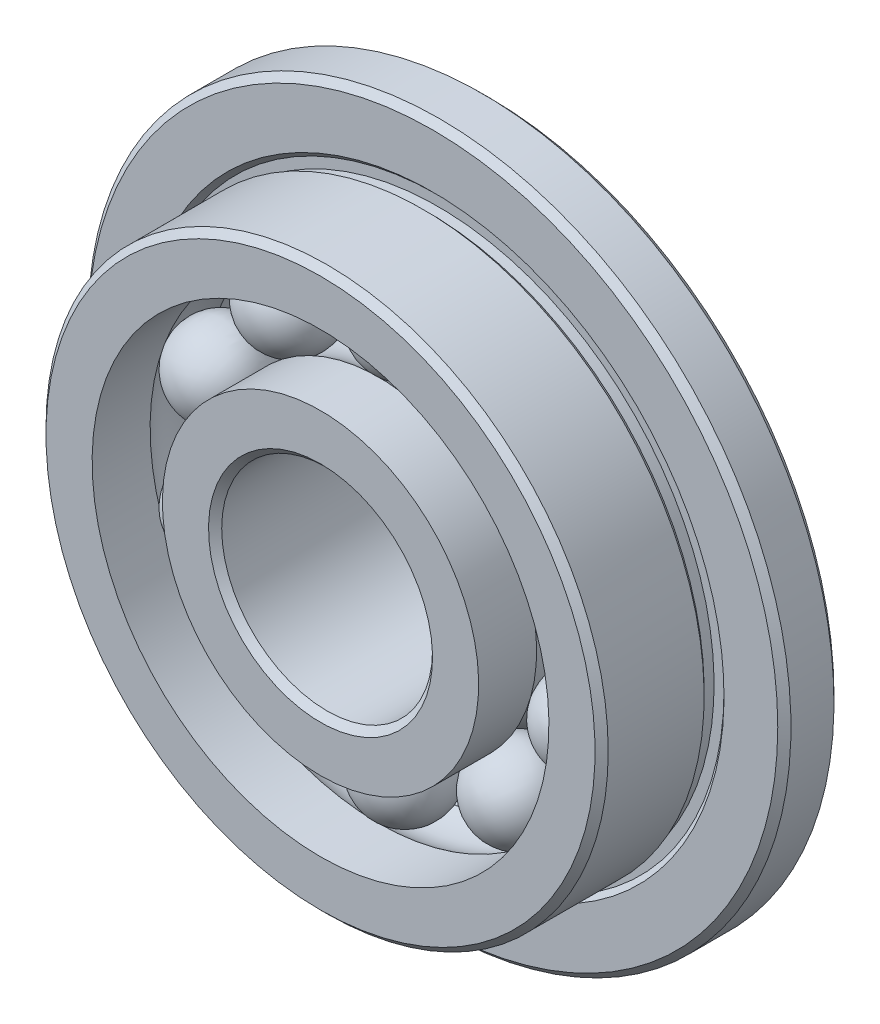
from build123d import *

# Parameters (mm, degrees)
FILLET1_SIZE      = 0.046875
FILLET2_SIZE      = 0.046875
CIRPATTERN3_COUNT = 10


with BuildPart() as part:
    # Sketch2 → Revolve1 (revolve)
    with BuildSketch(Plane(origin=(0, 0, 0), x_dir=(0, 0, -1), z_dir=(1, 0, 0)), mode=Mode.PRIVATE) as revolve1_sk:
        with BuildLine():
            Line((0.6, 2.5), (0.2, 2.5))
            Line((0.2, 2.5), (0.2, 2.070710678))
            Line((0.2, 2.070710678), (0.235355339, 2.035355339))
            Line((0.235355339, 2.035355339), (0.235355339, 1.964644661))
            Line((0.235355339, 1.964644661), (0.164644661, 1.964644661))
            Line((0.164644661, 1.964644661), (0.129289322, 2))
            Line((0.129289322, 2), (-0.6, 2))
            Line((-0.6, 2), (-0.6, 1.625))
            Line((-0.6, 1.625), (-0.1875, 1.625))
            ThreePointArc((-0.1875, 1.625), (0, 1.6875), (0.1875, 1.625))
            Line((0.1875, 1.625), (0.6, 1.625))
            Line((0.6, 1.625), (0.6, 2.5))
        make_face()
        with BuildLine():
            Line((0.6, 0.75), (-0.6, 0.75))
            Line((-0.6, 0.75), (-0.6, 1.125))
            Line((-0.6, 1.125), (-0.1875, 1.125))
            ThreePointArc((-0.1875, 1.125), (0, 1.0625), (0.1875, 1.125))
            Line((0.1875, 1.125), (0.6, 1.125))
            Line((0.6, 1.125), (0.6, 0.75))
        make_face()
    revolve(revolve1_sk.sketch.rotate(Axis((0, 0, 0), (0, 0, -1)), 180), axis=Axis((0, 0, 0), (0, 0, -1)))

    # Fillet1
    fillet1_edges = [part.edges().sort_by_distance(p)[0] for p in [
        (0, 2, 0.6),
        (0, 2.5, -0.6),
        (0, 2.5, -0.2),
    ]]
    chamfer(fillet1_edges, length=FILLET1_SIZE)

    # Fillet2
    fillet2_edges = [part.edges().sort_by_distance(p)[0] for p in [
        (0, 0.75, -0.6),
        (0, 0.75, 0.6),
    ]]
    chamfer(fillet2_edges, length=FILLET2_SIZE)


with BuildPart() as body_2:
    # Sketch7 → Revolve3 (revolve)
    with BuildSketch(Plane.XY):
        with BuildLine():
            Line((0, 1.6875), (0, 1.0625))
            ThreePointArc((0, 1.0625), (-0.3125, 1.375), (0, 1.6875))
        make_face()
    revolve(axis=Axis((0, 1.6875, 0), (0, -1, 0)))


with BuildPart() as cirpattern3_1:
    # CirPattern3: pattern copy
    add(body_2.part.rotate(Axis((0, 0, 0), (0, 0, 1)), 1 * 360 / CIRPATTERN3_COUNT))


with BuildPart() as cirpattern3_2:
    # CirPattern3: pattern copy
    add(body_2.part.rotate(Axis((0, 0, 0), (0, 0, 1)), 2 * 360 / CIRPATTERN3_COUNT))


with BuildPart() as cirpattern3_3:
    # CirPattern3: pattern copy
    add(body_2.part.rotate(Axis((0, 0, 0), (0, 0, 1)), 3 * 360 / CIRPATTERN3_COUNT))


with BuildPart() as cirpattern3_4:
    # CirPattern3: pattern copy
    add(body_2.part.rotate(Axis((0, 0, 0), (0, 0, 1)), 4 * 360 / CIRPATTERN3_COUNT))


with BuildPart() as cirpattern3_5:
    # CirPattern3: pattern copy
    add(body_2.part.rotate(Axis((0, 0, 0), (0, 0, 1)), 5 * 360 / CIRPATTERN3_COUNT))


with BuildPart() as cirpattern3_6:
    # CirPattern3: pattern copy
    add(body_2.part.rotate(Axis((0, 0, 0), (0, 0, 1)), 6 * 360 / CIRPATTERN3_COUNT))


with BuildPart() as cirpattern3_7:
    # CirPattern3: pattern copy
    add(body_2.part.rotate(Axis((0, 0, 0), (0, 0, 1)), 7 * 360 / CIRPATTERN3_COUNT))


with BuildPart() as cirpattern3_8:
    # CirPattern3: pattern copy
    add(body_2.part.rotate(Axis((0, 0, 0), (0, 0, 1)), 8 * 360 / CIRPATTERN3_COUNT))


with BuildPart() as cirpattern3_9:
    # CirPattern3: pattern copy
    add(body_2.part.rotate(Axis((0, 0, 0), (0, 0, 1)), 9 * 360 / CIRPATTERN3_COUNT))


solid = Compound([part.part, body_2.part, cirpattern3_1.part, cirpattern3_2.part, cirpattern3_3.part, cirpattern3_4.part, cirpattern3_5.part, cirpattern3_6.part, cirpattern3_7.part, cirpattern3_8.part, cirpattern3_9.part])
